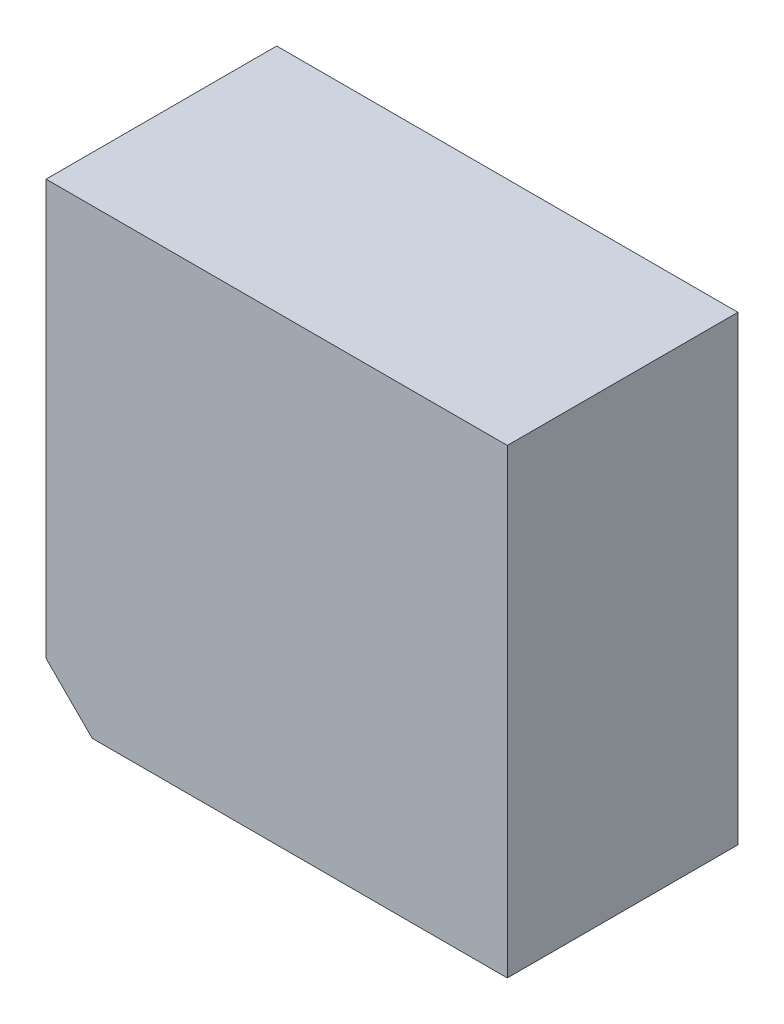
from build123d import *

# Parameters (mm, degrees)
SKETCH_1_W                = 20
SKETCH_1_H                = 20
BASEBOX_DEPTH             = 10
CHAMFERANGLEDISTANCE_SIZE = 2


with BuildPart() as part:
    # 草图1 → BaseBox (new body)
    with BuildSketch(Plane.XY):
        with Locations((10, 10)):
            Rectangle(SKETCH_1_W, SKETCH_1_H)
    extrude(amount=BASEBOX_DEPTH)

    # ChamferAngleDistance
    chamferangledistance_edges = [part.edges().sort_by_distance(p)[0] for p in [
        (0, 0, 5),
    ]]
    chamfer(chamferangledistance_edges, length=CHAMFERANGLEDISTANCE_SIZE)


solid = part.part
